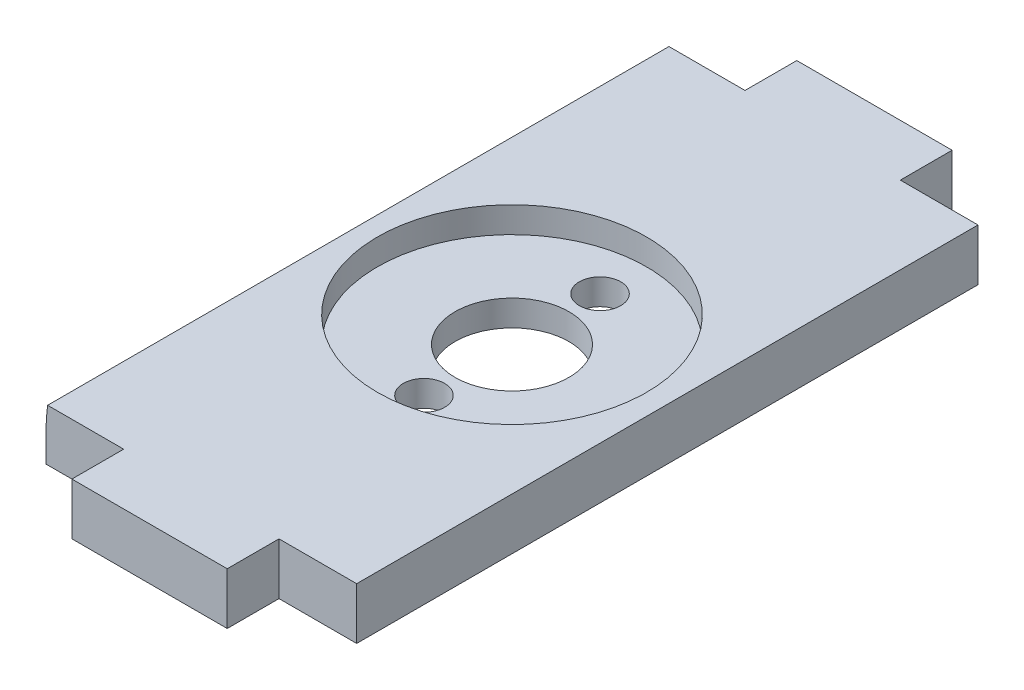
from build123d import *

# Parameters (mm, degrees)
SKETCH1_R           = 5.5
SKETCH1_R_2         = 2
BOSS_EXTRUDE1_DEPTH = 5
SKETCH2_R           = 13
CUT_EXTRUDE1_DEPTH  = 2.5
CUT_EXTRUDE2_DEPTH  = 60


with BuildPart() as part:
    # Sketch1 → Boss-Extrude1 (new body)
    with BuildSketch(Plane(origin=(0, 0, 0), x_dir=(1, 0, 0), z_dir=(0, 1, 0))):
        Polygon((7.5, -30), (15, -30), (15, 30), (7.5, 30), (7.5, 35), (-7.5, 35), (-7.5, 30), (-15, 30), (-15, -30), (-7.5, -30), (-7.5, -35), (7.5, -35), align=None)
        with Locations(Location((0, 0, 0), (0, 0, 270))):
            Circle(SKETCH1_R, mode=Mode.SUBTRACT)
        with Locations(Location((0, 8.5, 0), (0, 0, 270))):
            Circle(SKETCH1_R_2, mode=Mode.SUBTRACT)
        with Locations(Location((0, -8.5, 0), (0, 0, 270))):
            Circle(SKETCH1_R_2, mode=Mode.SUBTRACT)
    extrude(amount=BOSS_EXTRUDE1_DEPTH)

    # Sketch2 → Cut-Extrude1 (cut)
    with BuildSketch(Plane(origin=(0, 5, 0), x_dir=(1, 0, 0), z_dir=(0, 1, 0))):
        with Locations(Location((0, 0, 0), (0, 0, 270))):
            Circle(SKETCH2_R)
    extrude(amount=-CUT_EXTRUDE1_DEPTH, mode=Mode.SUBTRACT)

    # Sketch3 → Cut-Extrude2 (cut)
    with BuildSketch(Plane.XY.offset(30)):
        with BuildLine():
            Line((-15, 5), (-15, 2.5))
            ThreePointArc((-15, 2.5), (-14.960745185, 3.752458251), (-14.843134833, 5))
            Line((-14.843134833, 5), (-15, 5))
        make_face()
    extrude(amount=-CUT_EXTRUDE2_DEPTH, mode=Mode.SUBTRACT)


solid = part.part
